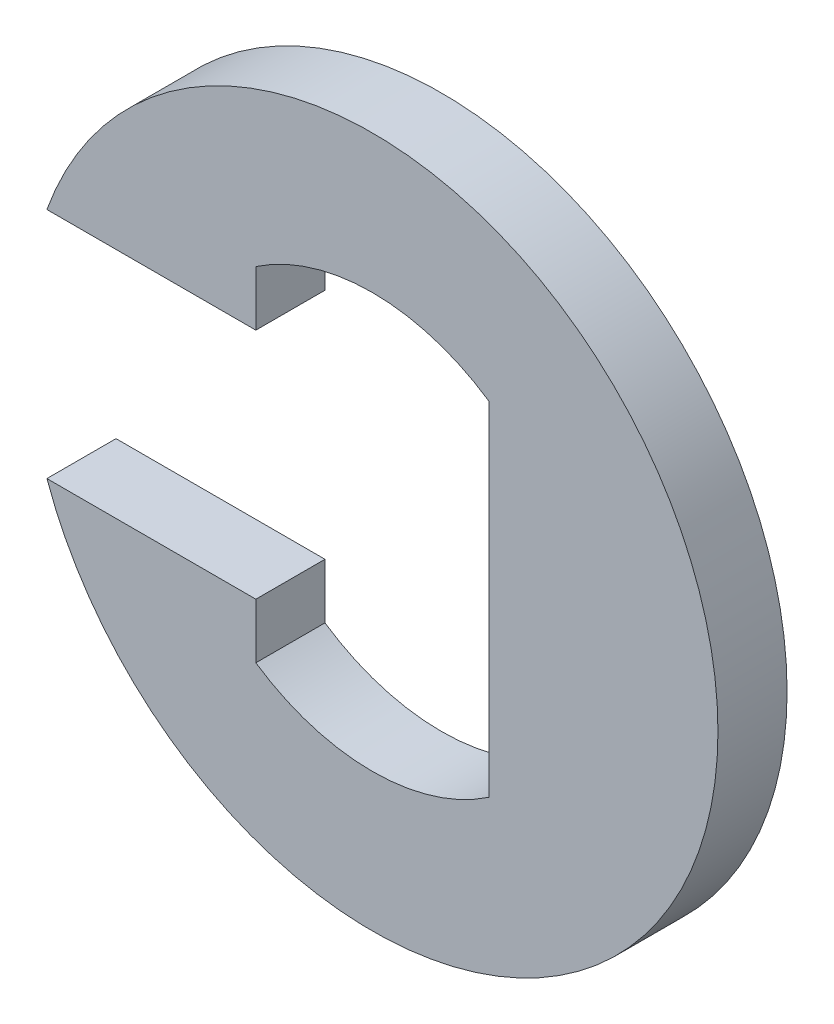
from build123d import *

# Parameters (mm, degrees)
SCHIZZO1_R                   = 10
ESTRUSIONE_ESTRUSIONE1_DEPTH = 1
TAGLIO_ESTRUSIONE1_DEPTH     = 15.282856857


with BuildPart() as part:
    # Schizzo1 → Estrusione-Estrusione1 (new, symmetric)
    with BuildSketch(Plane.XY):
        Circle(SCHIZZO1_R)
    extrude(amount=ESTRUSIONE_ESTRUSIONE1_DEPTH, both=True)

    # Schizzo2 → Taglio-Estrusione1 (cut, through all)
    with BuildSketch(Plane.XY.offset(1)):
        with BuildLine():
            Line((-3.37, -3.37), (-3.37, 3.37))
            Line((-3.37, 3.37), (-9.415046468, 3.37))
            ThreePointArc((-9.415046468, 3.37), (-10, 0), (-9.415046468, -3.37))
            Line((-9.415046468, -3.37), (-3.37, -3.37))
        make_face()
        with BuildLine():
            Line((-3.37, 4.964181705), (-3.37, -4.964181705))
            ThreePointArc((-3.37, -4.964181705), (0, -6), (3.37, -4.964181705))
            Line((3.37, -4.964181705), (3.37, 4.964181705))
            ThreePointArc((3.37, 4.964181705), (0, 6), (-3.37, 4.964181705))
        make_face()
    extrude(amount=-TAGLIO_ESTRUSIONE1_DEPTH, mode=Mode.SUBTRACT)


solid = part.part
